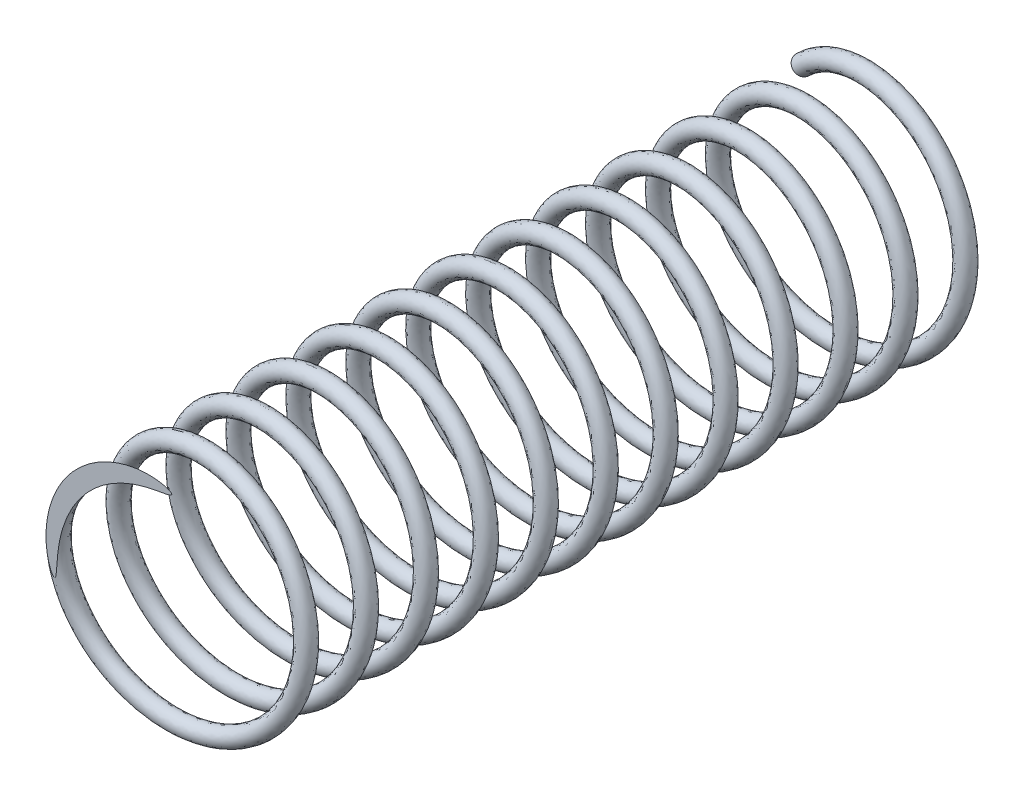
from build123d import *

# Parameters (mm, degrees)
SWEEP_1_PITCH            = 5
SWEEP_1_HEIGHT           = 76.25
SWEEP_1_RADIUS           = 9
SWEEP_1_START_ANGLE      = 135
SKETCH_2_R               = 0.75
CUT_EXTRUDE_1_DEPTH      = 79.271065186
CUT_EXTRUDE_1_DEPTH_BACK = 79.271065186


with BuildPart() as part:
    # 扫描1: sweep along a helix
    with BuildLine() as sweep_1_path:
        add(Helix(SWEEP_1_PITCH, SWEEP_1_HEIGHT, SWEEP_1_RADIUS, center=(0, 0, 0), direction=(0, 0, 1), lefthand=True, mode=Mode.PRIVATE).rotate(Axis((0, 0, 0), (0, 0, 1)), SWEEP_1_START_ANGLE))
    # 草图2 → 扫描1 (sweep)
    with BuildSketch(Plane(origin=(-6.363961031, 6.363961031, 0), x_dir=(0.7098441186958043, -0.6989158803830137, -0.08739519037918483), z_dir=(0.704358805689953, 0.7043588056899609, 0.08807579516549997))):
        with Locations((-0.031576311, -0.040353042)):
            Circle(SKETCH_2_R)
    sweep(path=sweep_1_path.line, is_frenet=True)

    # 草图3 → 切除-拉伸1 (cut, two sides: drawn at the far end of the back side and taken through both)
    with BuildSketch(Plane(origin=(0, 0, 0), x_dir=(0, 0, -1), z_dir=(1, 0, 0)).offset(-CUT_EXTRUDE_1_DEPTH_BACK)):
        Polygon((-60, -187.366861785), (-60, -31.051465207), (-60, 27.388782613), (-60, 183.704179192), (-372.630793157, 183.704179192), (-372.630793157, -187.366861785), align=None)
    extrude(amount=CUT_EXTRUDE_1_DEPTH + CUT_EXTRUDE_1_DEPTH_BACK, mode=Mode.SUBTRACT)


solid = part.part
